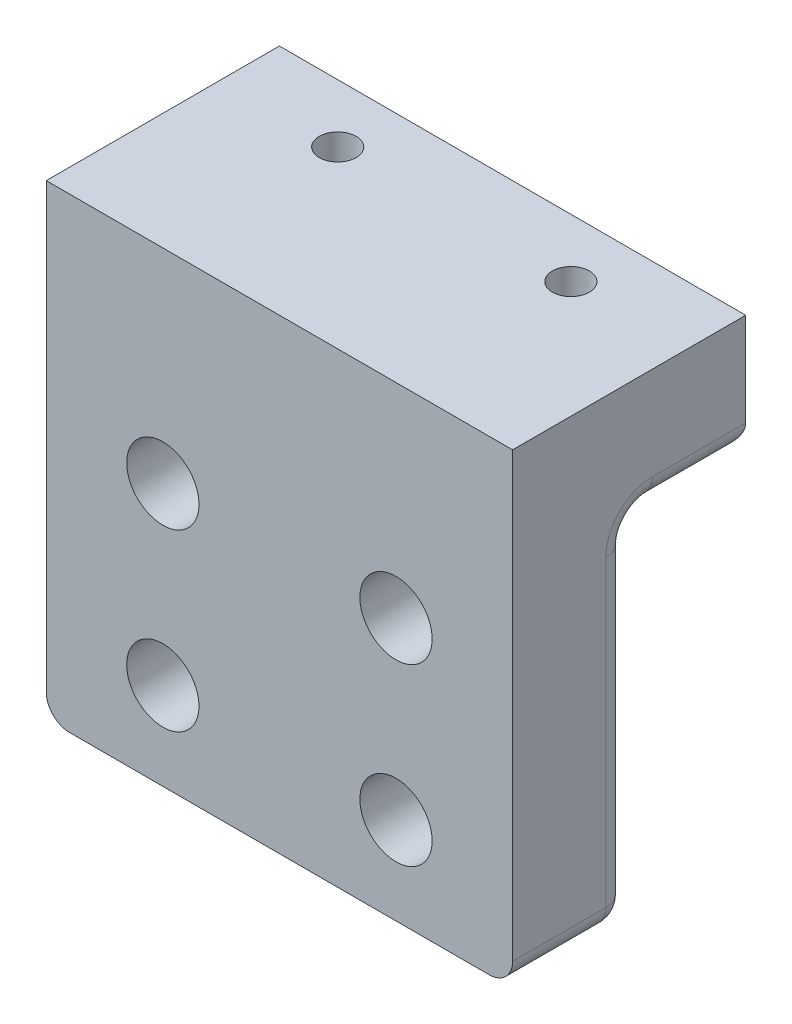
from build123d import *

# Parameters (mm, degrees)
SKETCH1_W           = 20
SKETCH1_H           = 15
SKETCH1_R           = 1.55
BOSS_EXTRUDE1_DEPTH = 5
SKETCH2_W           = 20
SKETCH2_H           = 10
SKETCH2_R           = 0.791259191
BOSS_EXTRUDE2_DEPTH = 5
FILLET1_R           = 1


with BuildPart() as part:
    # Sketch1 → Boss-Extrude1 (new body)
    with BuildSketch(Plane.XY):
        Rectangle(SKETCH1_W, SKETCH1_H)
        with Locations((-5, 3.75)):
            Circle(SKETCH1_R, mode=Mode.SUBTRACT)
        with Locations(Location((5, 3.75, 0), (0, 0, 180))):
            Circle(SKETCH1_R, mode=Mode.SUBTRACT)
        with Locations((5, -3.75)):
            Circle(SKETCH1_R, mode=Mode.SUBTRACT)
        with Locations(Location((-5, -3.75, 0), (0, 0, 180))):
            Circle(SKETCH1_R, mode=Mode.SUBTRACT)
    extrude(amount=BOSS_EXTRUDE1_DEPTH)

    # Sketch2 → Boss-Extrude2 (add)
    with BuildSketch(Plane(origin=(0, 7.5, 0), x_dir=(1, 0, 0), z_dir=(0, 1, 0))):
        Rectangle(SKETCH2_W, SKETCH2_H)
        with Locations(Location((-5, 2.5, 0), (0, 0, 270))):
            Circle(SKETCH2_R, mode=Mode.SUBTRACT)
        with Locations(Location((5, 2.5, 0), (0, 0, 90))):
            Circle(SKETCH2_R, mode=Mode.SUBTRACT)
    extrude(amount=BOSS_EXTRUDE2_DEPTH)

    # Fillet1
    fillet1_edges = [part.edges().sort_by_distance(p)[0] for p in [
        (-10, 7.5, -2.5),
        (10, 7.5, -2.5),
        (0, 7.5, -5),
        (0, 7.5, 0),
        (10, 0, 0),
        (0, -7.5, 0),
        (-10, 0, 0),
        (10, -7.5, 2.5),
        (-10, -7.5, 2.5),
    ]]
    fillet(fillet1_edges, radius=FILLET1_R)


solid = part.part
